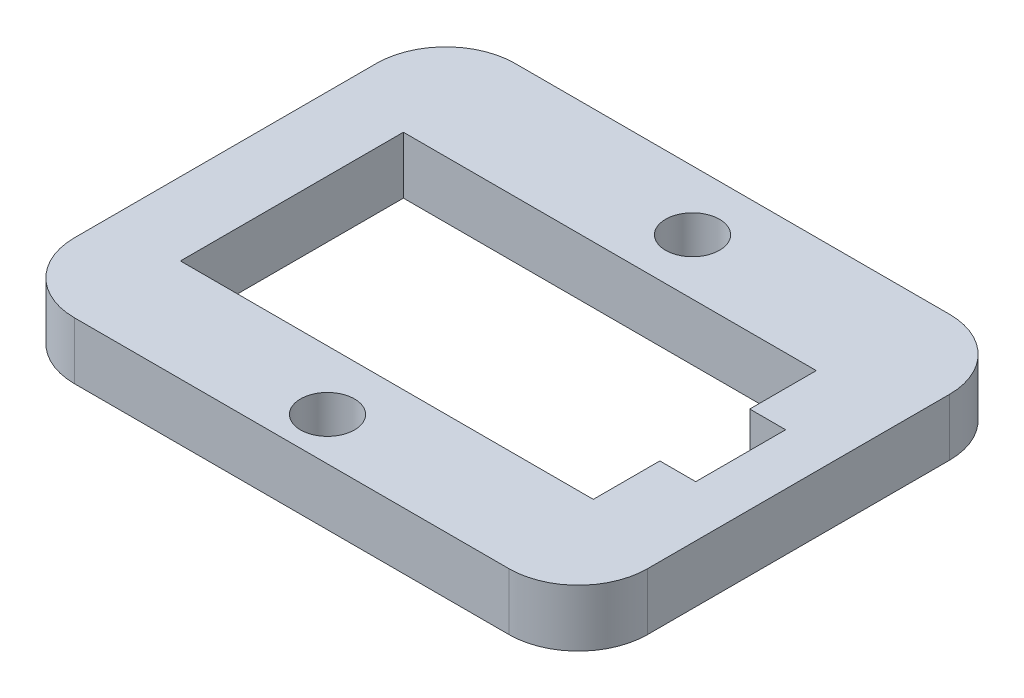
from build123d import *

# Parameters (mm, degrees)
SKETCH1_R           = 1.4986
BOSS_EXTRUDE1_DEPTH = 3.175


with BuildPart() as part:
    # Sketch1 → Boss-Extrude1 (new body)
    with BuildSketch(Plane(origin=(0, 0, 0), x_dir=(1, 0, 0), z_dir=(0, 1, 0))):
        with BuildLine():
            Line((-1.432123738, 15.756084407), (-25.583614521, 15.756084407))
            ThreePointArc((-25.583614521, 15.756084407), (-28.310130326, 14.626724582), (-29.439490151, 11.900208777))
            Line((-29.439490151, 11.900208777), (-29.439490151, -4.881885841))
            ThreePointArc((-29.439490151, -4.881885841), (-28.308084251, -7.613341307), (-25.576628785, -8.744747206))
            Line((-25.576628785, -8.744747206), (-1.425196823, -8.744747206))
            ThreePointArc((-1.425196823, -8.744747206), (1.301319065, -7.615387348), (2.430678924, -4.88887146))
            Line((2.430678924, -4.88887146), (2.430678924, 11.893281745))
            ThreePointArc((2.430678924, 11.893281745), (1.299290219, 14.624695701), (-1.432123738, 15.756084407))
        make_face()
        with Locations(Location((-12.398849753, 12.438862806, 0), (0, 0, 270))):
            Circle(SKETCH1_R, mode=Mode.SUBTRACT)
        with Locations(Location((-13.896396676, -6.361792876, 0), (0, 0, 270))):
            Circle(SKETCH1_R, mode=Mode.SUBTRACT)
        Polygon((-2.416750389, 9.338746066), (-25.375916231, 9.338746066), (-25.375916231, -3.061603704), (-2.416750389, -3.061603704), (-2.416750389, 0.638495937), (-0.420102398, 0.638495937), (-0.420102398, 5.638646425), (-2.416750389, 5.638646425), align=None, mode=Mode.SUBTRACT)
    extrude(amount=BOSS_EXTRUDE1_DEPTH)


solid = part.part
